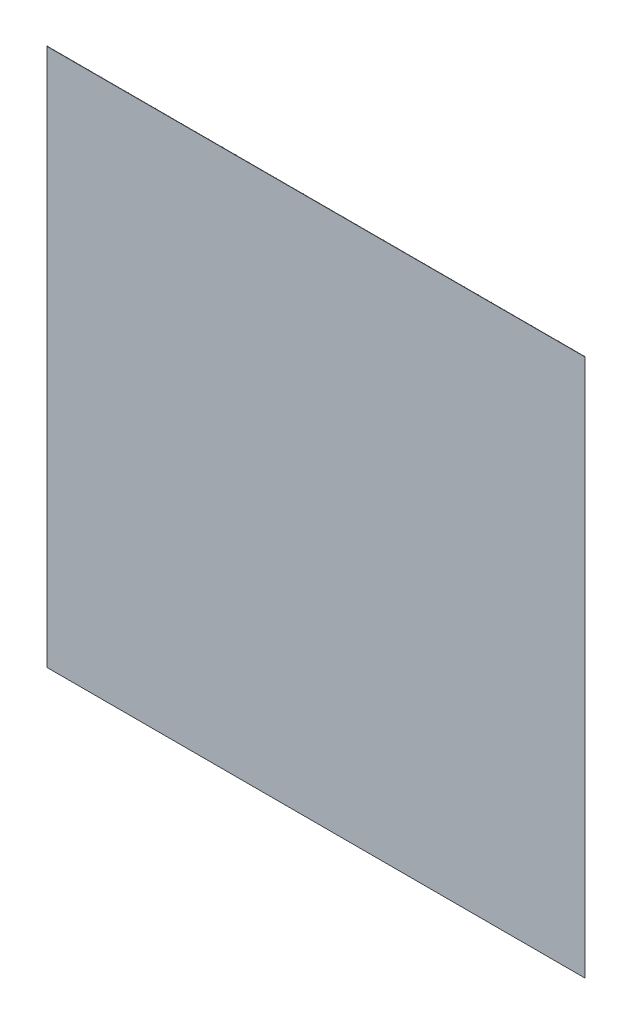
from build123d import *

# Parameters (mm, degrees)
EXTRUDE_1_DEPTH = 10000


with BuildPart() as part:
    # 草图1 → 凸台-拉伸1 (new body)
    with BuildSketch(Plane(origin=(0, 0, 0), x_dir=(1, 0, 0), z_dir=(0, 1, 0))):
        Polygon((0, 0), (10, 0), (10, -5), (250, -5), (250, 0), (260, 0), (260, -5), (500, -5), (500, 0), (510, 0), (510, -5), (750, -5), (750, 0), (760, 0), (760, -5), (1000, -5), (1000, 0), (1010, 0), (1010, -5), (1250, -5), (1250, 0), (1260, 0), (1260, -5), (1500, -5), (1500, 0), (1510, 0), (1510, -5), (1750, -5), (1750, 0), (1760, 0), (1760, -5), (2000, -5), (2000, 0), (2010, 0), (2010, -5), (2250, -5), (2250, 0), (2260, 0), (2260, -5), (2500, -5), (2500, 0), (2510, 0), (2510, -5), (2750, -5), (2750, 0), (2760, 0), (2760, -5), (3000, -5), (3000, 0), (3010, 0), (3010, -5), (3250, -5), (3250, 0), (3260, 0), (3260, -5), (3500, -5), (3500, 0), (3510, 0), (3510, -5), (3750, -5), (3750, 0), (3760, 0), (3760, -5), (4000, -5), (4000, 0), (4010, 0), (4010, -5), (4250, -5), (4250, 0), (4260, 0), (4260, -5), (4500, -5), (4500, 0), (4510, 0), (4510, -5), (4750, -5), (4750, 0), (4760, 0), (4760, -5), (5000, -5), (5000, 0), (5010, 0), (5010, -5), (5250, -5), (5250, 0), (5260, 0), (5260, -5), (5500, -5), (5500, 0), (5510, 0), (5510, -5), (5750, -5), (5750, 0), (5760, 0), (5760, -5), (6000, -5), (6000, 0), (6010, 0), (6010, -5), (6250, -5), (6250, 0), (6260, 0), (6260, -5), (6500, -5), (6500, 0), (6510, 0), (6510, -5), (6750, -5), (6750, 0), (6760, 0), (6760, -5), (7000, -5), (7000, 0), (7010, 0), (7010, -5), (7250, -5), (7250, 0), (7260, 0), (7260, -5), (7500, -5), (7500, 0), (7510, 0), (7510, -5), (7750, -5), (7750, 0), (7760, 0), (7760, -5), (8000, -5), (8000, 0), (8010, 0), (8010, -5), (8250, -5), (8250, 0), (8260, 0), (8260, -5), (8500, -5), (8500, 0), (8510, 0), (8510, -5), (8750, -5), (8750, 0), (8760, 0), (8760, -5), (9000, -5), (9000, 0), (9010, 0), (9010, -5), (9250, -5), (9250, 0), (9260, 0), (9260, -5), (9500, -5), (9500, 0), (9510, 0), (9510, -5), (9750, -5), (9750, 0), (9760, 0), (9760, -5), (10000, -5), (10000, -10), (0, -10), align=None)
    extrude(amount=EXTRUDE_1_DEPTH)


solid = part.part
